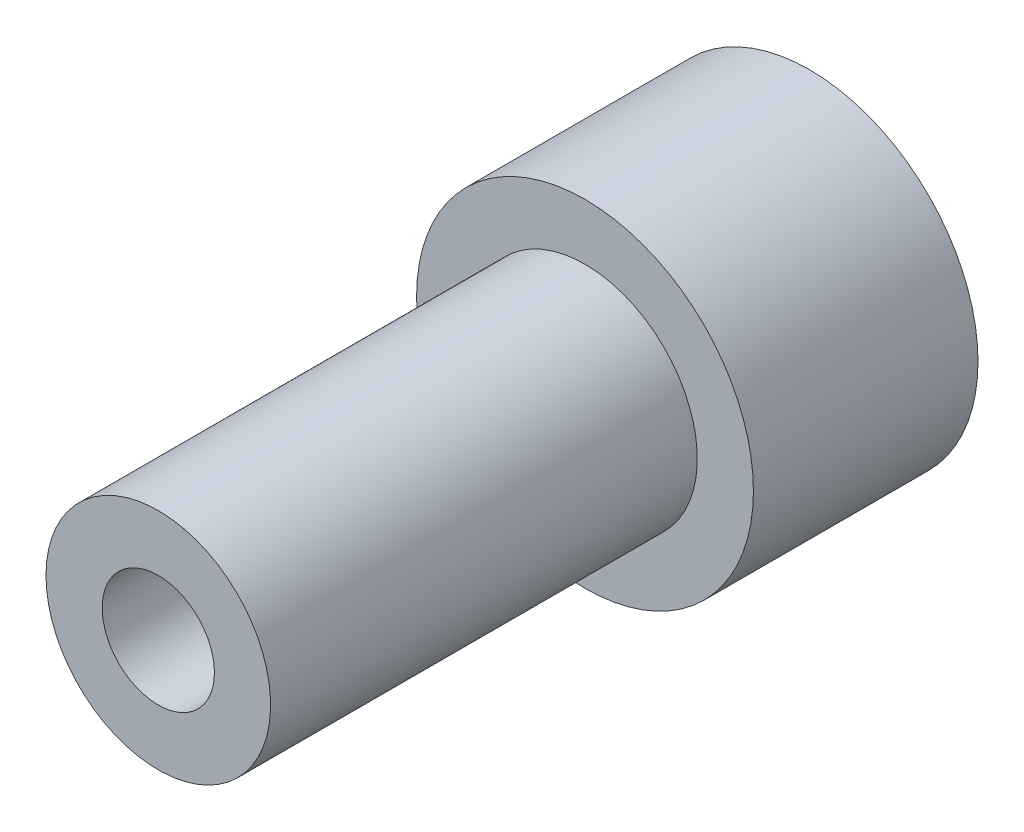
from build123d import *

# Parameters (mm, degrees)
SKETCH1_R           = 7.5
BOSS_EXTRUDE1_DEPTH = 250
SKETCH2_R           = 5
CUT_EXTRUDE1_DEPTH  = 10
SKETCH3_R           = 9.435011435
SKETCH3_R_2         = 5
CUT_EXTRUDE2_DEPTH  = 19
SKETCH5_R           = 25.765699078
CUT_EXTRUDE3_DEPTH  = 221
SKETCH6_R           = 6.015267085
BOSS_EXTRUDE2_DEPTH = 10
SKETCH7_R           = 2.5
CUT_EXTRUDE4_DEPTH  = 10


with BuildPart() as part:
    # Sketch1 → Boss-Extrude1 (new body)
    with BuildSketch(Plane.XY):
        Circle(SKETCH1_R)
    extrude(amount=BOSS_EXTRUDE1_DEPTH)

    # Sketch2 → Cut-Extrude1 (cut)
    with BuildSketch(Plane.XY):
        Circle(SKETCH2_R)
    extrude(amount=CUT_EXTRUDE1_DEPTH, mode=Mode.SUBTRACT)

    # Sketch3 → Cut-Extrude2 (cut)
    with BuildSketch(Plane(origin=(0, 0, 10), x_dir=(-1, 0, 0), z_dir=(0, 0, -1))):
        Circle(SKETCH3_R)
        Circle(SKETCH3_R_2, mode=Mode.SUBTRACT)
    extrude(amount=-CUT_EXTRUDE2_DEPTH, mode=Mode.SUBTRACT)


with BuildPart() as cut_extrude2_piece_1:
    # of the separate pieces the step leaves, piece 1, a body of its own (cut_extrude2_pieces)
    add(part.part.solids().sort_by_distance((7.5, 0, 29))[0])

    # Sketch5 → Cut-Extrude3 (cut)
    with BuildSketch(Plane(origin=(0, 0, 29), x_dir=(-1, 0, 0), z_dir=(0, 0, -1))):
        Circle(SKETCH5_R)
    extrude(amount=-CUT_EXTRUDE3_DEPTH, mode=Mode.SUBTRACT)



with BuildPart() as cut_extrude2_piece_2:
    # of the separate pieces the step leaves, piece 2, a body of its own (cut_extrude2_pieces)
    add(part.part.solids().sort_by_distance((7.5, 0, 0))[0])


with BuildPart() as cut_extrude2_piece_1_1:
    add(cut_extrude2_piece_1.part)

    add(cut_extrude2_piece_2.part)  # Boss-Extrude2 merges Cut-Extrude2 piece 2
    # Sketch6 → Boss-Extrude2 (add)
    with BuildSketch(Plane(origin=(0, 0, 10), x_dir=(-1, 0, 0), z_dir=(0, 0, -1))):
        Circle(SKETCH6_R)
    extrude(amount=BOSS_EXTRUDE2_DEPTH)

    # Sketch7 → Cut-Extrude4 (cut)
    with BuildSketch(Plane.XY.offset(29)):
        Circle(SKETCH7_R)
    extrude(amount=-CUT_EXTRUDE4_DEPTH, mode=Mode.SUBTRACT)


solid = cut_extrude2_piece_1_1.part
